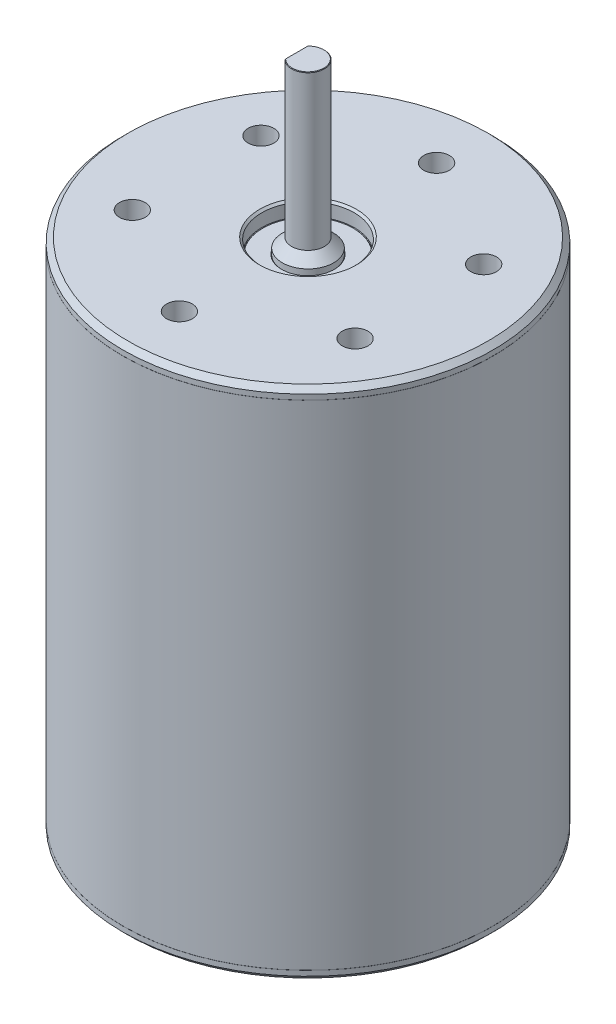
from build123d import *

# Parameters (mm, degrees)
ESQUISSE2_W                  = 0.5
ESQUISSE2_H                  = 2.313006702
ENL_V_MAT_EXTRU_1_DEPTH      = 12
R_P_TITION_CIRCULAIRE1_COUNT = 6


with BuildPart() as part:
    # Esquisse1 → Révolution1 (revolve)
    with BuildSketch(Plane.XY, mode=Mode.PRIVATE) as r_volution1_sk:
        Polygon((0, 65), (-1.5375, 65), (-1.5875, 64.95), (-1.5875, 50), (-2.5, 49.0875), (-2.5, 48.5), (-2.55, 48.55), (-4.4, 48.55), (-4.45, 48.5), (-4.5, 48.55), (-4.5, 49.8), (-4.7, 50), (-17.5, 50), (-18, 49.5), (-18, 49), (-17.995, 48.995), (-18, 48.99), (-18, 1.01), (-17.995, 1.005), (-18, 1), (-18, 0.5), (-17.5, 0), (-4.7, 0), (-4.5, 0.2), (-4.5, 1.45), (-4.45, 1.5), (-4.4, 1.45), (-2.55, 1.45), (-2.5, 1.5), (-2.45, 1.45), (0, 1.45), align=None)
    revolve(r_volution1_sk.sketch.rotate(Axis((0, -4.92112906, 0), (0, 1, 0)), 270), axis=Axis((0, -4.92112906, 0), (0, 1, 0)))

    # Esquisse2 → Enlèv. mat.-Extru.1 (cut)
    with BuildSketch(Plane(origin=(0, 65, 0), x_dir=(1, 0, 0), z_dir=(0, 1, 0))):
        with Locations((-1.3375, 0)):
            Rectangle(ESQUISSE2_W, ESQUISSE2_H)
    extrude(amount=-ENL_V_MAT_EXTRU_1_DEPTH, mode=Mode.SUBTRACT)

    # Esquisse4 → Trou taraudé M31 (revolve, cut)
    with BuildSketch(Plane(origin=(0, 50, -12.5), x_dir=(0, 0, 1), z_dir=(1, 0, 0))):
        Polygon((0, 0), (0, 7.751075774), (1.25, 7), (1.25, 0), align=None)
    trou_taraud_m31 = revolve(axis=Axis((0, 56.35, -12.5), (0, -1, 0)), mode=Mode.SUBTRACT)

    # Répétition circulaire1: Trou taraudé M31 ×6 about axis
    r_p_tition_circulaire1_axis = Axis((0, 0, 0), (0, 1, 0))
    for i in range(1, R_P_TITION_CIRCULAIRE1_COUNT):
        add(trou_taraud_m31.rotate(r_p_tition_circulaire1_axis, i * 360 / R_P_TITION_CIRCULAIRE1_COUNT), mode=Mode.SUBTRACT)


solid = part.part
